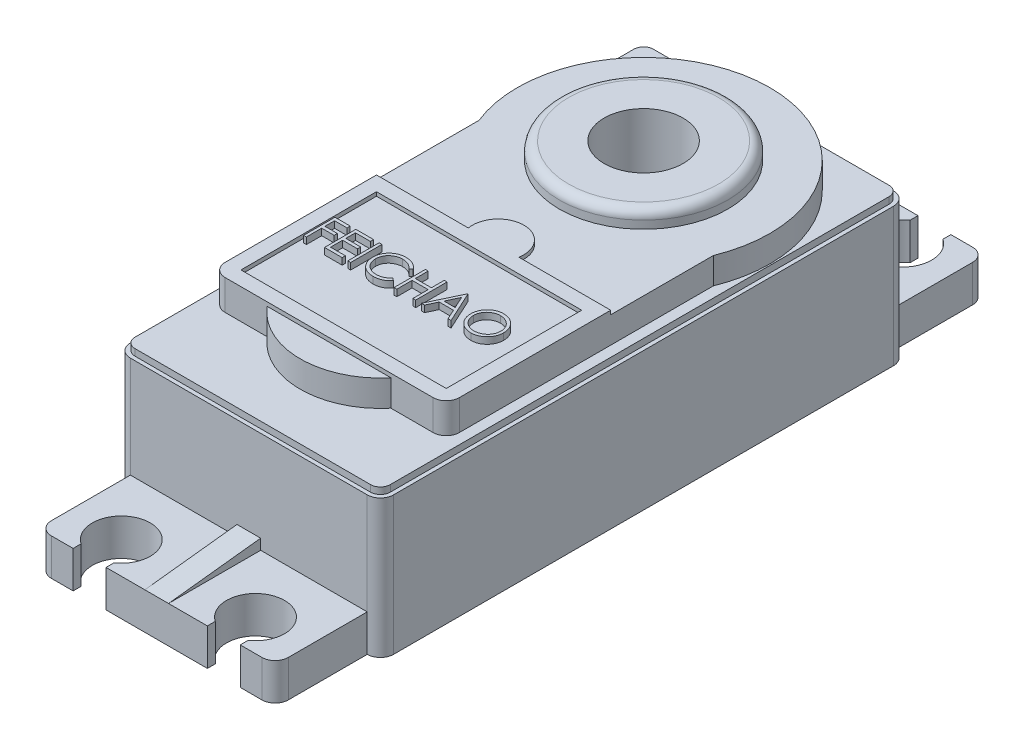
from build123d import *

# Parameters (mm, degrees)
BASES_W                              = 20
BASES_H                              = 40
BASE_DEPTH                           = 11
SHAFTHOLES_R                         = 3
SHAFT_HOLE_DEPTH                     = 25.919871589
MOUNTINGTABS_W                       = 18
MOUNTINGTABS_H                       = 2.8
MOUNTING_TAB_DEPTH                   = 7
MOUNTING_HOLE_DEPTH                  = 30.937267744
BOTTOMALIGNHOLES_R                   = 0.7
BOTTOM_ALIGN_HOLE_DEPTH              = 0.5
TRIANGULAR_TAB_DEPTH                 = 0.9
MOUNTING_TAB_FEATURES_M_COPY_1_DEPTH = 30.937267744
BASE_START                           = 2
BASETOPBODYS_R                       = 3
BASE_TOP_BODY_DEPTH                  = 2
PART_CIRCLE_DEPTH                    = 2
TOP_START                            = 1.3
TOPBODYCYLINDER1_R                   = 6.4
TOPBODYCYLINDER1_R_2                 = 3
TOP_BODY_CYLINDER_1_DEPTH            = 1.3
TOPBODYLABELNEST_W                   = 17.8
TOPBODYLABELNEST_H                   = 12.5
TOPBODYLABELNEST_W_2                 = 15.6
TOPBODYLABELNEST_H_2                 = 10.3
TOP_BODY_LABEL_NEST_DEPTH            = 0.3
PART_CIRCLE_2_DEPTH                  = 0.3
BORDERCUTS_W                         = 20
BORDERCUTS_H                         = 40
BORDERCUTS_W_2                       = 19.4
BORDERCUTS_H_2                       = 39.4
BORDER_CUT_DEPTH                     = 0.5
MAIN_BODY_FEATURES_F_R               = 1
BORDER_CUT_F_R                       = 0.75
ESQUISSE1_W                          = 0.213701924
ESQUISSE1_H                          = 2.38125
BOSS_EXTRU_1_DEPTH                   = 0.5
CONG_1_R                             = 0.7


with BuildPart() as part:
    # BaseS → BASE (new body)
    with BuildSketch(Plane(origin=(0, 0, 0), x_dir=(1, 0, 0), z_dir=(0, 1, 0))):
        Rectangle(BASES_W, BASES_H)
    extrude(amount=BASE_DEPTH)

    # ShaftHoleS → SHAFT HOLE (cut, through all)
    with BuildSketch(Plane(origin=(0, 11, 0), x_dir=(1, 0, 0), z_dir=(0, 1, 0))):
        with Locations(Location((0, 10, 0), (0, 0, 270))):
            Circle(SHAFTHOLES_R)
    extrude(amount=-SHAFT_HOLE_DEPTH, mode=Mode.SUBTRACT)

    # MountingTabS → MOUNTING TAB (add)
    with BuildSketch(Plane.XY.offset(20)):
        with Locations((0, 1.4)):
            Rectangle(MOUNTINGTABS_W, MOUNTINGTABS_H)
    mounting_tab = extrude(amount=MOUNTING_TAB_DEPTH)

    # MountingHoleS → MOUNTING HOLE (cut, through all)
    with BuildSketch(Plane(origin=(0, 2.8, 0), x_dir=(1, 0, 0), z_dir=(0, 1, 0))):
        with BuildLine():
            Line((-6.35, -26.4), (-6.35, -27))
            Line((-6.35, -27), (-3.85, -27))
            Line((-3.85, -27), (-3.85, -26.4))
            ThreePointArc((-3.85, -26.4), (-5.1, -22.389613301), (-6.35, -26.4))
        make_face()
    mounting_hole = extrude(amount=-MOUNTING_HOLE_DEPTH, mode=Mode.SUBTRACT)

    # MH M: MOUNTING HOLE across plane
    add(mounting_hole.mirror(Plane(origin=(0, 0, 0), x_dir=(0, 0, 1), z_dir=(1, 0, 0))), mode=Mode.SUBTRACT)

    # BottomAlignHoleS → BOTTOM ALIGN HOLE (cut)
    with BuildSketch(Plane.XZ):
        with Locations(Location((0, 25, 0), (0, 0, 270))):
            Circle(BOTTOMALIGNHOLES_R)
    bottom_align_hole = extrude(amount=-BOTTOM_ALIGN_HOLE_DEPTH, mode=Mode.SUBTRACT)

    # TriangularTabS → TRIANGULAR TAB (add, symmetric)
    with BuildSketch(Plane(origin=(0, 0, 0), x_dir=(0, 0, -1), z_dir=(1, 0, 0))):
        Polygon((-20, 2.8), (-27, 2.8), (-20, 3.6), align=None)
    triangular_tab = extrude(amount=TRIANGULAR_TAB_DEPTH, both=True)

    # MOUNTING TAB FEATURES M: MOUNTING TAB, MOUNTING HOLE, BOTTOM ALIGN HOLE, TRIANGULAR TAB across plane
    add(mounting_tab.mirror(Plane.XY))
    add(mounting_hole.mirror(Plane.XY), mode=Mode.SUBTRACT)
    add(bottom_align_hole.mirror(Plane.XY), mode=Mode.SUBTRACT)
    add(triangular_tab.mirror(Plane.XY))

    # MOUNTING TAB FEATURES M copy 1 sketch → MOUNTING TAB FEATURES M copy 1 (cut, through all)
    with BuildSketch(Plane(origin=(0, 2.8, 0), x_dir=(-1, 0, 0), z_dir=(0, 1, 0))):
        with BuildLine():
            Line((-6.35, -26.4), (-6.35, -27))
            Line((-6.35, -27), (-3.85, -27))
            Line((-3.85, -27), (-3.85, -26.4))
            ThreePointArc((-3.85, -26.4), (-5.1, -22.389613301), (-6.35, -26.4))
        make_face()
    extrude(amount=-MOUNTING_TAB_FEATURES_M_COPY_1_DEPTH, mode=Mode.SUBTRACT)

    # BaseTopBodyS → BASE TOP BODY (add)
    with BuildSketch(Plane(origin=(0, 11, 0), x_dir=(1, 0, 0), z_dir=(0, 1, 0)).offset(BASE_START)):
        with BuildLine():
            Line((-8.9, -13.898610843), (8.9, -13.898610843))
            Line((8.9, -13.898610843), (8.9, 6.401389157))
            ThreePointArc((8.9, 6.401389157), (0, 19.6), (-8.9, 6.401389157))
            Line((-8.9, 6.401389157), (-8.9, -13.898610843))
        make_face()
        with Locations(Location((0, 10, 0), (0, 0, 270))):
            Circle(BASETOPBODYS_R, mode=Mode.SUBTRACT)
    extrude(amount=-BASE_TOP_BODY_DEPTH)

    # PartCircleS → PART CIRCLE (add)
    with BuildSketch(Plane(origin=(0, 11, 0), x_dir=(1, 0, 0), z_dir=(0, 1, 0))):
        with BuildLine():
            Line((-4.7, -13.898610843), (4.7, -13.898610843))
            ThreePointArc((4.7, -13.898610843), (0, -16.098610843), (-4.7, -13.898610843))
        make_face()
    extrude(amount=PART_CIRCLE_DEPTH)

    # TopBodyCylinder1 → TOP BODY CYLINDER 1 (add)
    with BuildSketch(Plane(origin=(0, 13, 0), x_dir=(1, 0, 0), z_dir=(0, 1, 0)).offset(TOP_START)):
        with Locations(Location((0, 10, 0), (0, 0, 270))):
            Circle(TOPBODYCYLINDER1_R)
        with Locations(Location((0, 10, 0), (0, 0, 270))):
            Circle(TOPBODYCYLINDER1_R_2, mode=Mode.SUBTRACT)
    extrude(amount=-TOP_BODY_CYLINDER_1_DEPTH)

    # TopBodyLabelNest → TOP BODY LABEL NEST (add)
    with BuildSketch(Plane(origin=(0, 13, 0), x_dir=(1, 0, 0), z_dir=(0, 1, 0))):
        with Locations((0, -7.648610843)):
            Rectangle(TOPBODYLABELNEST_W, TOPBODYLABELNEST_H)
        with Locations((0, -7.648610843)):
            Rectangle(TOPBODYLABELNEST_W_2, TOPBODYLABELNEST_H_2, mode=Mode.SUBTRACT)
    extrude(amount=TOP_BODY_LABEL_NEST_DEPTH)

    # PartCircle2S → PART CIRCLE 2 (add)
    with BuildSketch(Plane(origin=(0, 13, 0), x_dir=(1, 0, 0), z_dir=(0, 1, 0))):
        with BuildLine():
            Line((1.303840481, -2.498610843), (-1.303840481, -2.498610843))
            ThreePointArc((-1.303840481, -2.498610843), (0, 0.901389157), (1.303840481, -2.498610843))
        make_face()
    extrude(amount=PART_CIRCLE_2_DEPTH)

    # BorderCutS → BORDER CUT (cut)
    with BuildSketch(Plane(origin=(0, 11, 0), x_dir=(1, 0, 0), z_dir=(0, 1, 0))):
        Rectangle(BORDERCUTS_W, BORDERCUTS_H)
        Rectangle(BORDERCUTS_W_2, BORDERCUTS_H_2, mode=Mode.SUBTRACT)
    extrude(amount=-BORDER_CUT_DEPTH, mode=Mode.SUBTRACT)

    # MAIN BODY FEATURES F
    main_body_features_f_edges = [part.edges().sort_by_distance(p)[0] for p in [
        (9, 1.4, -27),
        (-9, 1.4, -27),
        (-10, 5.25, -20),
        (10, 5.25, -20),
        (-8.9, 12.15, 13.898610843),
        (8.9, 12.15, 13.898610843),
        (-10, 5.25, 20),
        (10, 5.25, 20),
        (9, 1.4, 27),
        (-9, 1.4, 27),
    ]]
    fillet(main_body_features_f_edges, radius=MAIN_BODY_FEATURES_F_R)

    # BORDER CUT F
    border_cut_f_edges = [part.edges().sort_by_distance(p)[0] for p in [
        (9.7, 10.75, -19.7),
        (9.7, 10.75, 19.7),
        (-9.7, 10.75, 19.7),
        (-9.7, 10.75, -19.7),
    ]]
    fillet(border_cut_f_edges, radius=BORDER_CUT_F_R)

    # Esquisse1 → Boss.-Extru.1 (add)
    # profile 1 of 7: a face of its own
    with BuildSketch(Plane(origin=(0, 13, 0), x_dir=(1, 0, 0), z_dir=(0, 1, 0))):
        Polygon((-7.494711538, -5.958443128), (-6.334615385, -5.958443128), (-6.334615385, -6.202673897), (-7.281009615, -6.202673897), (-7.281009615, -6.935366205), (-6.334615385, -6.935366205), (-6.334615385, -7.179596974), (-7.281009615, -7.179596974), (-7.281009615, -8.339693128), (-7.494711538, -8.339693128), align=None)
    # profile 2 of 7: a face of its own
    with BuildSketch(Plane(origin=(0, 13, 0), x_dir=(1, 0, 0), z_dir=(0, 1, 0))):
        Polygon((-5.907211538, -5.958443128), (-4.563942308, -5.958443128), (-4.563942308, -6.202673897), (-5.693509615, -6.202673897), (-5.693509615, -6.935366205), (-4.563942308, -6.935366205), (-4.563942308, -7.179596974), (-5.693509615, -7.179596974), (-5.693509615, -8.095462359), (-4.563942308, -8.095462359), (-4.563942308, -8.339693128), (-5.907211538, -8.339693128), align=None)
    # profile 3 of 7: a face of its own
    with BuildSketch(Plane(origin=(0, 13, 0), x_dir=(1, 0, 0), z_dir=(0, 1, 0))):
        with Locations((-4.0296875, -7.149068128)):
            Rectangle(ESQUISSE1_W, ESQUISSE1_H)
    # profile 4 of 7: a face of its own
    with BuildSketch(Plane(origin=(0, 13, 0), x_dir=(1, 0, 0), z_dir=(0, 1, 0))):
        with BuildLine():
            Line((-1.114182692, -6.395387239), (-1.301171875, -6.538491205))
            add(Edge.make_bspline(
                [(-1.301171875, -6.538491205), (-1.314510881, -6.522594001), (-1.341009055, -6.49101392), (-1.383639691, -6.446668552), (-1.42806813, -6.405122365), (-1.474277389, -6.366177443), (-1.523099219, -6.331195679), (-1.573350941, -6.29835409), (-1.625873182, -6.268916575), (-1.698502487, -6.233223008), (-1.793512898, -6.19597607), (-1.913116173, -6.164745479), (-2.03796926, -6.144864643), (-2.123148341, -6.142711421), (-2.166473858, -6.141616205)],
                knots=[0, 0, 0, 0, 0.757959112, 1.505699292, 2.245454638, 2.979532153, 3.711538275, 4.438200793, 5.171680507, 5.909471876, 7.393775596, 8.890124382, 10.418191784, 12, 12, 12, 12], degree=3))
            add(Edge.make_bspline(
                [(-2.166473858, -6.141616205), (-2.190343031, -6.141891044), (-2.23785985, -6.142438171), (-2.308377829, -6.149656165), (-2.37757903, -6.159801113), (-2.445418438, -6.174854235), (-2.511809701, -6.193885606), (-2.577186853, -6.216626825), (-2.64060335, -6.244762886), (-2.702936473, -6.275860827), (-2.762657686, -6.310985928), (-2.819164781, -6.349299119), (-2.872251667, -6.390371665), (-2.921960337, -6.434357507), (-2.968341609, -6.481058555), (-3.011059404, -6.530972509), (-3.049965906, -6.583939791), (-3.085832311, -6.639261949), (-3.117953831, -6.696777839), (-3.144848267, -6.756700342), (-3.168664252, -6.818003312), (-3.18750963, -6.88137937), (-3.202426131, -6.946382573), (-3.212718345, -7.013187377), (-3.219854251, -7.08165422), (-3.220398657, -7.128060913), (-3.220673077, -7.151453194)],
                knots=[0, 0, 0, 0, 1.054917814, 2.100044995, 3.131103042, 4.146048494, 5.169673617, 6.183595914, 7.203665975, 8.234915748, 9.262203917, 10.264457458, 11.251630812, 12.227803204, 13.197192746, 14.159520551, 15.12972552, 16.100847026, 17.073214652, 18.039054194, 19.002613845, 19.979014051, 20.95965708, 21.949030935, 22.966165397, 24, 24, 24, 24], degree=3))
            add(Edge.make_bspline(
                [(-3.220673077, -7.151453194), (-3.219814589, -7.186648967), (-3.218129063, -7.255751199), (-3.203128321, -7.356968347), (-3.180332893, -7.453933305), (-3.146168367, -7.546039948), (-3.104041298, -7.634424027), (-3.050809739, -7.717590104), (-2.989158131, -7.796794945), (-2.918214285, -7.870166665), (-2.840377471, -7.937191182), (-2.756865052, -7.99621256), (-2.667885028, -8.045412506), (-2.574419856, -8.086353641), (-2.475750304, -8.117824736), (-2.372053804, -8.139979971), (-2.263555893, -8.15443224), (-2.189417784, -8.155815874), (-2.151686448, -8.156520051)],
                knots=[0, 0, 0, 0, 1.029171465, 2.020641659, 2.987623507, 3.938342917, 4.889210282, 5.84687017, 6.821220943, 7.821438502, 8.827599549, 9.822697543, 10.807740252, 11.797342354, 12.80366471, 13.83203677, 14.896651826, 16, 16, 16, 16], degree=3))
            add(Edge.make_bspline(
                [(-2.151686448, -8.156520051), (-2.110114797, -8.155371078), (-2.028291844, -8.153109623), (-1.908298597, -8.133951277), (-1.793429978, -8.102887587), (-1.683679808, -8.059414179), (-1.579357486, -8.002900117), (-1.480299758, -7.934389597), (-1.386423011, -7.853230927), (-1.329972906, -7.79126187), (-1.301171875, -7.759645051)],
                knots=[0, 0, 0, 0, 1.028121516, 2.023589091, 2.998037872, 3.967518031, 4.937445131, 5.927275754, 6.942489185, 8, 8, 8, 8], degree=3))
            Line((-1.301171875, -7.759645051), (-1.114182692, -7.901317978))
            add(Edge.make_bspline(
                [(-1.114182692, -7.901317978), (-1.129230906, -7.920734317), (-1.159255254, -7.959473994), (-1.207872227, -8.014087425), (-1.259087674, -8.065457134), (-1.313282005, -8.113168962), (-1.369831788, -8.158177626), (-1.429752415, -8.199204407), (-1.492256167, -8.236821955), (-1.557131268, -8.271266345), (-1.624308789, -8.301826115), (-1.693708235, -8.327988411), (-1.765030465, -8.350525166), (-1.838278742, -8.369066216), (-1.913604998, -8.383538149), (-1.990737409, -8.393212607), (-2.06984245, -8.399840588), (-2.123210631, -8.400444688), (-2.150255409, -8.40075082)],
                knots=[0, 0, 0, 0, 0.986787822, 1.968848986, 2.935600012, 3.899624008, 4.868462664, 5.837806735, 6.815139263, 7.798259679, 8.787526145, 9.778297419, 10.776456485, 11.791383307, 12.812564526, 13.85620153, 14.913611965, 16, 16, 16, 16], degree=3))
            add(Edge.make_bspline(
                [(-2.150255409, -8.40075082), (-2.175866546, -8.400572572), (-2.2265094, -8.400220108), (-2.301279801, -8.394510437), (-2.374070926, -8.386720526), (-2.444674734, -8.37499108), (-2.513476513, -8.361149663), (-2.579852554, -8.342595469), (-2.64445601, -8.321811125), (-2.707027327, -8.297382911), (-2.76761973, -8.269817437), (-2.826037787, -8.238662822), (-2.882254632, -8.204181054), (-2.936822963, -8.167132198), (-2.988936676, -8.126326213), (-3.039047378, -8.082329806), (-3.087436062, -8.035291266), (-3.117373604, -8.001372161), (-3.132425631, -7.984318278)],
                knots=[0, 0, 0, 0, 1.114604814, 2.203992996, 3.262667896, 4.300477797, 5.318619304, 6.316056647, 7.298880507, 8.271930387, 9.238335007, 10.195173496, 11.151986948, 12.108099108, 13.064862484, 14.031167946, 15.010108607, 16, 16, 16, 16], degree=3))
            add(Edge.make_bspline(
                [(-3.132425631, -7.984318278), (-3.156534524, -7.954694719), (-3.204461247, -7.895805243), (-3.265778899, -7.800360674), (-3.31826679, -7.700709982), (-3.360704693, -7.596329637), (-3.393880767, -7.487453861), (-3.416864044, -7.37402777), (-3.431798975, -7.256157295), (-3.433506868, -7.175986195), (-3.434375, -7.135234745)],
                knots=[0, 0, 0, 0, 0.994628077, 1.977248131, 2.950237994, 3.925870899, 4.908910175, 5.911660606, 6.938484602, 8, 8, 8, 8], degree=3))
            add(Edge.make_bspline(
                [(-3.434375, -7.135234745), (-3.433316913, -7.092402552), (-3.431235193, -7.008132887), (-3.413548768, -6.88446168), (-3.385097051, -6.765976532), (-3.344685954, -6.652898627), (-3.29345142, -6.544633204), (-3.230160099, -6.442007313), (-3.155547275, -6.344364633), (-3.070198126, -6.25318674), (-2.976603207, -6.169816216), (-2.8763738, -6.096469495), (-2.769706082, -6.035429543), (-2.657775187, -5.984405368), (-2.539742964, -5.945186545), (-2.415861243, -5.917731967), (-2.286362803, -5.900643357), (-2.198009974, -5.898483082), (-2.153117488, -5.897385436)],
                knots=[0, 0, 0, 0, 1.032925535, 2.032216505, 3.007276963, 3.968222605, 4.92396291, 5.891752235, 6.871517503, 7.883894988, 8.900124299, 9.891468569, 10.874487609, 11.85992873, 12.854644235, 13.869047385, 14.917252991, 16, 16, 16, 16], degree=3))
            add(Edge.make_bspline(
                [(-2.153117488, -5.897385436), (-2.125757285, -5.897713462), (-2.071600518, -5.898362757), (-1.99148666, -5.904694257), (-1.913488934, -5.91524905), (-1.837553605, -5.929615519), (-1.763311253, -5.947445857), (-1.691329304, -5.970673453), (-1.621185376, -5.997232236), (-1.553321854, -6.027820049), (-1.488064344, -6.062155457), (-1.425433171, -6.099857873), (-1.365925829, -6.140880554), (-1.309123595, -6.184874608), (-1.255976673, -6.23277077), (-1.204976095, -6.283251635), (-1.157853826, -6.337771254), (-1.128766384, -6.376146754), (-1.114182692, -6.395387239)],
                knots=[0, 0, 0, 0, 1.096760587, 2.17092713, 3.219439832, 4.250915756, 5.268269357, 6.278326846, 7.281116186, 8.274029601, 9.260640565, 10.235837813, 11.203064059, 12.156899882, 13.114053108, 14.069676657, 15.032185724, 16, 16, 16, 16], degree=3))
        make_face()
    # profile 5 of 7: a face of its own
    with BuildSketch(Plane(origin=(0, 13, 0), x_dir=(1, 0, 0), z_dir=(0, 1, 0))):
        Polygon((-0.625721154, -5.958443128), (-0.412019231, -5.958443128), (-0.412019231, -6.935366205), (0.809134615, -6.935366205), (0.809134615, -5.958443128), (1.022836538, -5.958443128), (1.022836538, -8.339693128), (0.809134615, -8.339693128), (0.809134615, -7.179596974), (-0.412019231, -7.179596974), (-0.412019231, -8.339693128), (-0.625721154, -8.339693128), align=None)
    # profile 6 of 7: a face of its own
    with BuildSketch(Plane(origin=(0, 13, 0), x_dir=(1, 0, 0), z_dir=(0, 1, 0))):
        Polygon((2.610336538, -5.958443128), (3.709375, -8.339693128), (3.477069561, -8.339693128), (3.125033804, -7.576471974), (2.045552885, -7.576471974), (1.68349985, -8.339693128), (1.450240385, -8.339693128), (2.579807692, -5.958443128), align=None)
        Polygon((2.592687049, -6.422576992), (2.161467097, -7.332241205), (3.012458684, -7.332241205), align=None, mode=Mode.SUBTRACT)
    # profile 7 of 7: a face of its own
    with BuildSketch(Plane(origin=(0, 13, 0), x_dir=(1, 0, 0), z_dir=(0, 1, 0))):
        with BuildLine():
            add(Edge.make_bspline(
                [(5.251081731, -5.897385436), (5.295174389, -5.898502228), (5.381776006, -5.9006957), (5.509053749, -5.917486304), (5.630562198, -5.946534418), (5.747291167, -5.985221554), (5.857844425, -6.036829627), (5.9630541, -6.099208273), (6.062669866, -6.173011006), (6.155349056, -6.25766732), (6.240160302, -6.349776419), (6.314881128, -6.448072998), (6.37750276, -6.551962718), (6.42892809, -6.661133391), (6.469272323, -6.775338119), (6.497111887, -6.895185753), (6.514895164, -7.019899769), (6.516974184, -7.104962689), (6.518028846, -7.148114102)],
                knots=[0, 0, 0, 0, 1.065120563, 2.091984664, 3.0946048, 4.079830382, 5.057816894, 6.036188127, 7.030412546, 8.04752943, 9.064399622, 10.05169764, 11.02544977, 11.989514704, 12.962713494, 13.945757189, 14.957906945, 16, 16, 16, 16], degree=3))
            add(Edge.make_bspline(
                [(6.518028846, -7.148114102), (6.516974338, -7.19094765), (6.514895782, -7.275377536), (6.497091667, -7.399300129), (6.46916913, -7.518424335), (6.429302741, -7.632551288), (6.37812255, -7.741801381), (6.315083942, -7.845887148), (6.24082894, -7.944842712), (6.156323922, -8.037584007), (6.064202855, -8.122626929), (5.965394406, -8.196730664), (5.862120737, -8.260496542), (5.753052882, -8.311376149), (5.639637321, -8.352042402), (5.52085899, -8.379768745), (5.39727446, -8.397653322), (5.312997938, -8.399706991), (5.27016226, -8.40075082)],
                knots=[0, 0, 0, 0, 1.043624062, 2.057103931, 3.04512605, 4.022047818, 4.998200453, 5.980619268, 6.982898556, 8.009068085, 9.034988726, 10.034168286, 11.015286542, 11.987931943, 12.962482838, 13.94673481, 14.956375938, 16, 16, 16, 16], degree=3))
            add(Edge.make_bspline(
                [(5.27016226, -8.40075082), (5.227011071, -8.399696684), (5.141948592, -8.397618701), (5.017077859, -8.379805995), (4.897146037, -8.351951286), (4.782496094, -8.312143973), (4.673064098, -8.26069725), (4.568636024, -8.197965342), (4.469631032, -8.123529412), (4.376869951, -8.039051797), (4.291995943, -7.947086866), (4.218000725, -7.848547846), (4.15525471, -7.745367972), (4.103980729, -7.637260907), (4.063387588, -7.524749265), (4.035693774, -7.407082533), (4.017775921, -7.284931547), (4.015711141, -7.201762718), (4.014663462, -7.159562419)],
                knots=[0, 0, 0, 0, 1.053102029, 2.075944431, 3.073151272, 4.055350789, 5.033113405, 6.020478099, 7.024410459, 8.052272461, 9.079885166, 10.07527673, 11.055994387, 12.023226415, 12.992069828, 13.970394897, 14.97016774, 16, 16, 16, 16], degree=3))
            add(Edge.make_bspline(
                [(4.014663462, -7.159562419), (4.015027205, -7.131237335), (4.015750102, -7.074944501), (4.024453021, -6.991351332), (4.037081607, -6.90910251), (4.055180409, -6.828431918), (4.078851168, -6.749537034), (4.106781208, -6.671873747), (4.14089421, -6.596229106), (4.179457293, -6.522244763), (4.222497916, -6.451074027), (4.270038382, -6.383800597), (4.320408873, -6.319859954), (4.375628968, -6.260909046), (4.433878728, -6.205232933), (4.496103089, -6.153687228), (4.561922366, -6.105807127), (4.631619771, -6.062658645), (4.703477918, -6.023633948), (4.777553012, -5.99014551), (4.852839001, -5.961403101), (4.929688502, -5.938107111), (5.007897442, -5.919715672), (5.087636513, -5.907192097), (5.168842191, -5.898466981), (5.223550606, -5.897747502), (5.251081731, -5.897385436)],
                knots=[0, 0, 0, 0, 1.037015668, 2.060948919, 3.074880161, 4.083647147, 5.086022904, 6.090072063, 7.104153813, 8.122640571, 9.144368836, 10.147691507, 11.138137339, 12.123020368, 13.103399296, 14.087645067, 15.080126199, 16.082011238, 17.087798457, 18.072939717, 19.057185487, 20.037253025, 21.01195951, 21.997135196, 22.992090687, 24, 24, 24, 24], degree=3))
        make_face()
        with BuildLine():
            add(Edge.make_bspline(
                [(5.261576022, -6.141616205), (5.238978208, -6.141891675), (5.193998619, -6.142439981), (5.127130032, -6.149662459), (5.061140877, -6.159956187), (4.996017526, -6.174639329), (4.932032461, -6.194644587), (4.868589265, -6.21766849), (4.806266473, -6.245713554), (4.745269831, -6.277399626), (4.686136539, -6.312471302), (4.630338611, -6.351232451), (4.577731598, -6.392774074), (4.528444304, -6.437193121), (4.482621453, -6.484715796), (4.439361148, -6.53462165), (4.400397379, -6.588337133), (4.364688441, -6.644405642), (4.332733536, -6.702754146), (4.304318178, -6.762768356), (4.281074451, -6.824937818), (4.262118084, -6.888588058), (4.246401963, -6.953618267), (4.236445668, -7.020521764), (4.229143831, -7.088962367), (4.228626865, -7.135214307), (4.228365385, -7.158608393)],
                knots=[0, 0, 0, 0, 1.008559885, 2.007477868, 2.99961109, 3.989939068, 4.984837346, 5.991145699, 7.001802488, 8.033829008, 9.059044045, 10.069351652, 11.065060232, 12.050310815, 13.029377138, 14.011219647, 14.996725999, 15.989392538, 16.977580475, 17.965360261, 18.951710183, 19.937753436, 20.929683414, 21.935841486, 22.955955122, 24, 24, 24, 24], degree=3))
            add(Edge.make_bspline(
                [(4.228365385, -7.158608393), (4.229232746, -7.193008761), (4.230939114, -7.260684927), (4.245878104, -7.359859325), (4.268889126, -7.455169391), (4.302809941, -7.546093618), (4.345230627, -7.633413568), (4.397636422, -7.716354618), (4.459725193, -7.794939184), (4.530253414, -7.868618644), (4.607353327, -7.935869093), (4.689222559, -7.994899198), (4.774984031, -8.044844385), (4.864861389, -8.085533194), (4.958374804, -8.11777514), (5.056126852, -8.139872209), (5.157466361, -8.154415153), (5.226543467, -8.15581176), (5.261576022, -8.156520051)],
                knots=[0, 0, 0, 0, 1.032063989, 2.030389145, 3.003944642, 3.970395727, 4.937377036, 5.913328081, 6.909231446, 7.93887556, 8.970685674, 9.976071282, 10.964166581, 11.944589148, 12.933237628, 13.927779006, 14.949070134, 16, 16, 16, 16], degree=3))
            add(Edge.make_bspline(
                [(5.261576022, -8.156520051), (5.285122843, -8.156196538), (5.331823263, -8.155554915), (5.401284681, -8.149092423), (5.46949471, -8.138729312), (5.536357679, -8.123808633), (5.601797703, -8.10513473), (5.666087917, -8.08294983), (5.72854354, -8.055272082), (5.789952465, -8.024691422), (5.848732765, -7.989829815), (5.904845583, -7.952384217), (5.956876562, -7.91090378), (6.006126984, -7.867144697), (6.052137965, -7.820224651), (6.094598363, -7.770204643), (6.133365203, -7.716768945), (6.16906058, -7.660785482), (6.200903514, -7.602277317), (6.228647866, -7.542045518), (6.25218558, -7.480238399), (6.271186938, -7.416766812), (6.286076868, -7.351751306), (6.296336599, -7.285104828), (6.303513305, -7.216960704), (6.304054241, -7.170870688), (6.304326923, -7.147637088)],
                knots=[0, 0, 0, 0, 1.047197238, 2.076906641, 3.100256066, 4.114471768, 5.12198147, 6.126382909, 7.136867548, 8.15857795, 9.17633901, 10.174870724, 11.156907918, 12.133735059, 13.104061851, 14.077631395, 15.04955518, 16.038496417, 17.029181396, 18.010275684, 18.986308667, 19.968651475, 20.955262928, 21.950658345, 22.966943676, 24, 24, 24, 24], degree=3))
            add(Edge.make_bspline(
                [(6.304326923, -7.147637088), (6.304054023, -7.124562433), (6.303512675, -7.078789603), (6.296340028, -7.011120725), (6.286066029, -6.944953808), (6.271259615, -6.880548613), (6.252175493, -6.817888724), (6.228643755, -6.75703299), (6.200895185, -6.6977547), (6.169048876, -6.640200366), (6.133251324, -6.584972553), (6.094134705, -6.532175198), (6.051023638, -6.482799815), (6.00514986, -6.43562746), (5.955367526, -6.391664218), (5.90190214, -6.350895503), (5.845402781, -6.312337436), (5.785580858, -6.277553794), (5.723842561, -6.245431254), (5.660491815, -6.217910125), (5.596246302, -6.194524808), (5.531269397, -6.174578802), (5.465014192, -6.160013695), (5.397928373, -6.149653183), (5.330104754, -6.142442495), (5.284491421, -6.141892509), (5.261576022, -6.141616205)],
                knots=[0, 0, 0, 0, 1.02996197, 2.043119294, 3.035359645, 4.018872909, 4.991431989, 5.957985074, 6.929999688, 7.912076566, 8.892894881, 9.867085534, 10.843653904, 11.817741046, 12.803660682, 13.806313499, 14.818574707, 15.856120519, 16.894564902, 17.924820532, 18.937903209, 19.946497019, 20.957711757, 21.963978472, 22.977135795, 24, 24, 24, 24], degree=3))
        make_face(mode=Mode.SUBTRACT)
    extrude(amount=BOSS_EXTRU_1_DEPTH)

    # Congé1
    cong_1_edges = [part.edges().sort_by_distance(p)[0] for p in [
        (0, 14.3, -16.4),
    ]]
    fillet(cong_1_edges, radius=CONG_1_R)


solid = part.part
